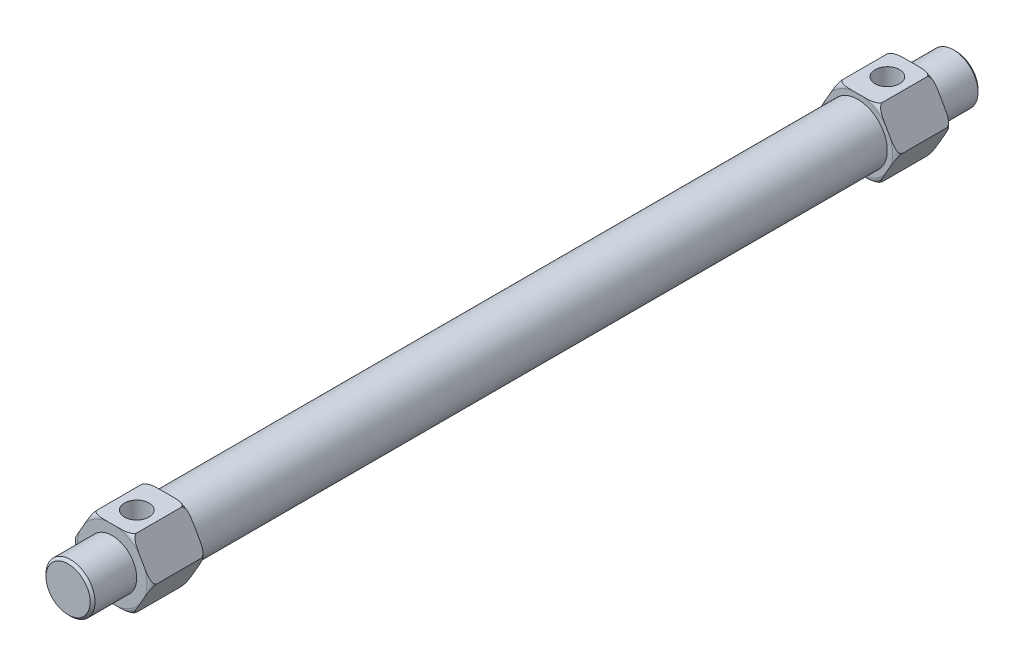
from build123d import *

# Parameters (mm, degrees)
BASE_EXTRUDE_DEPTH      = 70.5
BASE_EXTRUDE_DEPTH_BACK = 70.5
SKETCH1_R               = 6
HEADCOVERHEX_DEPTH      = 11
PORT_START              = -7
SKETCH8_R               = 2.5
PORT_DEPTH              = 7


with BuildPart() as part:
    # Sketch1 → Base-Extrude (new, two sides: drawn at the far end of the back side and taken through both)
    with BuildSketch(Plane.XY.offset(-BASE_EXTRUDE_DEPTH_BACK)):
        with Locations(Location((0, 0, 0), (0, 0, 180))):
            Circle(SKETCH1_R)
    extrude(amount=BASE_EXTRUDE_DEPTH + BASE_EXTRUDE_DEPTH_BACK)

    # Sketch7 → HeadCover (revolve)
    with BuildSketch(Plane(origin=(0, 0, 0), x_dir=(0, 0, -1), z_dir=(1, 0, 0)), mode=Mode.PRIVATE) as headcover_sk:
        Polygon((-70.5, 6), (-70.5, 0), (-90.5, 0), (-90.5, 4.5), (-90, 5), (-71.5, 5), align=None)
    headcover = revolve(headcover_sk.sketch.rotate(Axis((0, 0, 0), (0, 0, 1)), 90), axis=Axis((0, 0, 0), (0, 0, 1)))

    # Sketch2 → HeadCoverHex (add)
    with BuildSketch(Plane.XY.offset(70.5)):
        Polygon((8.082903769, 0), (4.041451884, 7), (-4.041451884, 7), (-8.082903769, 0), (-4.041451884, -7), (4.041451884, -7), align=None)
    headcoverhex = extrude(amount=HEADCOVERHEX_DEPTH)

    # Sketch8 → Port (cut)
    with BuildSketch(Plane(origin=(0, 7, 0), x_dir=(-1, 0, 0), z_dir=(0, 1, 0)).offset(PORT_START)):
        with Locations(Location((0, 76.5, 0), (0, 0, 90))):
            Circle(SKETCH8_R)
    port = extrude(amount=PORT_DEPTH, mode=Mode.SUBTRACT)

    # Sketch9 → HexRound (revolve, cut)
    with BuildSketch(Plane(origin=(0, 0, 0), x_dir=(0, 0, -1), z_dir=(0, 1, 0))):
        with BuildLine():
            Line((-81.5, 8.082903769), (-81.5, 7.082903769))
            ThreePointArc((-81.5, 7.082903769), (-81.207106781, 7.79001055), (-80.5, 8.082903769))
            Line((-80.5, 8.082903769), (-81.5, 8.082903769))
        make_face()
        with BuildLine():
            Line((-70.5, 8.082903769), (-71.5, 8.082903769))
            ThreePointArc((-71.5, 8.082903769), (-70.792893219, 7.79001055), (-70.5, 7.082903769))
            Line((-70.5, 7.082903769), (-70.5, 8.082903769))
        make_face()
    hexround = revolve(axis=Axis((0, 0, 0), (0, 0, 1)), mode=Mode.SUBTRACT)

    # HexCoverMirror: HeadCover, HeadCoverHex, Port, HexRound across plane
    add(headcover.mirror(Plane.XY))
    add(headcoverhex.mirror(Plane.XY))
    add(port.mirror(Plane.XY), mode=Mode.SUBTRACT)
    add(hexround.mirror(Plane.XY), mode=Mode.SUBTRACT)


solid = part.part
